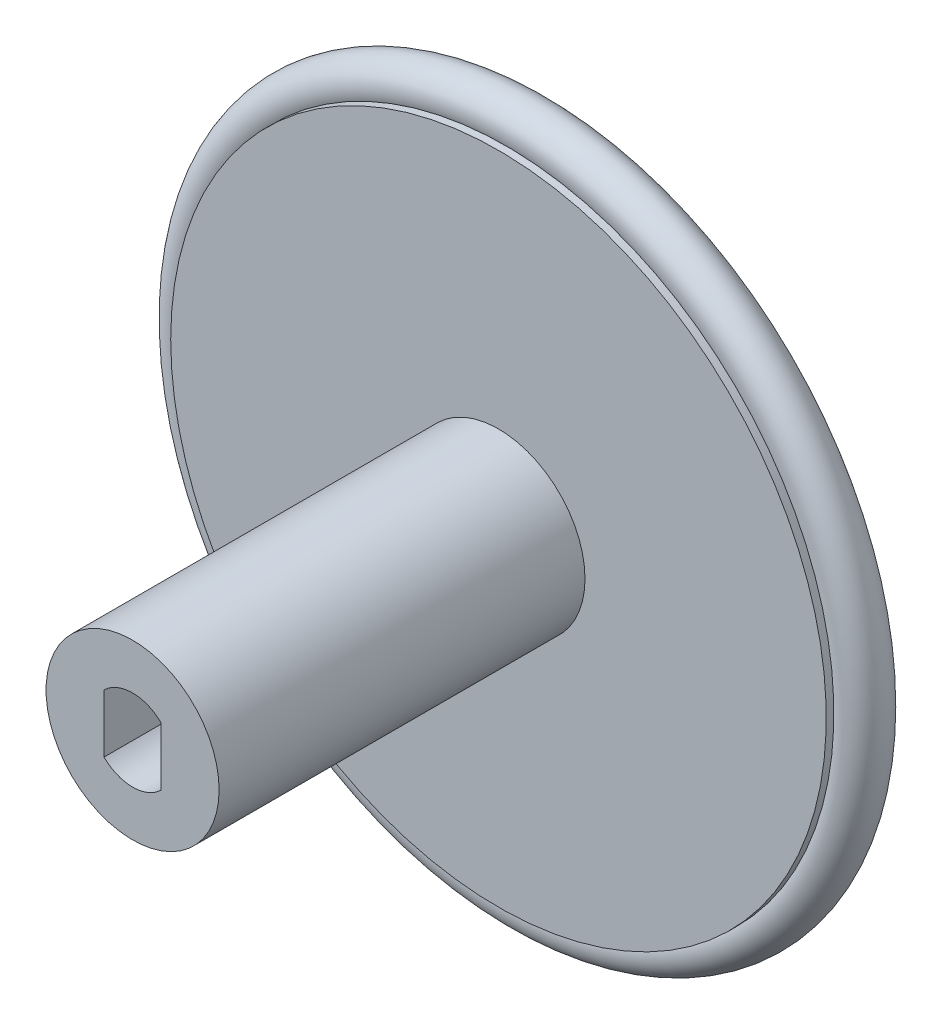
from build123d import *

# Parameters (mm, degrees)
CROQUIS3_R              = 5.675
SALIENTE_EXTRUIR2_DEPTH = 24
SALIENTE_EXTRUIR3_REACH = 48.199
SALIENTE_EXTRUIR3_START = -5
CROQUIS5_R              = 1.5


with BuildPart() as part:
    # Croquis1 → Revolución1 (revolve)
    with BuildSketch(Plane(origin=(0, 0, 0), x_dir=(0, 0, -1), z_dir=(1, 0, 0)), mode=Mode.PRIVATE) as revoluci_n1_sk:
        Polygon((-1.9, 0), (-1.9, 21.5), (-1.4, 21.5), (-0.5, 19.000153831), (0.5, 19.000153831), (1.4, 21.5), (1.9, 21.5), (1.9, 0), align=None)
    revolve(revoluci_n1_sk.sketch.rotate(Axis((0, 0, -6.227056579), (0, 0, 1)), 90), axis=Axis((0, 0, -6.227056579), (0, 0, 1)))

    # Croquis3 → Saliente-Extruir2 (add)
    with BuildSketch(Plane.XY.offset(1.9)):
        Circle(CROQUIS3_R)
        with BuildLine():
            Line((-1.875, 1.907878403), (-1.875, -1.907878403))
            ThreePointArc((-1.875, -1.907878403), (0, -2.675), (1.875, -1.907878403))
            Line((1.875, -1.907878403), (1.875, 1.907878403))
            ThreePointArc((1.875, 1.907878403), (0, 2.675), (-1.875, 1.907878403))
        make_face(mode=Mode.SUBTRACT)
    extrude(amount=SALIENTE_EXTRUIR2_DEPTH)

    # Croquis4 → Saliente-Extruir3 (add, up to next)
    with BuildSketch(Plane.XY.offset(25.9).offset(SALIENTE_EXTRUIR3_START), mode=Mode.PRIVATE) as saliente_extruir3_sk1:
        with BuildLine():
            Line((-1.875, 1.907878403), (-1.875, -1.907878403))
            ThreePointArc((-1.875, -1.907878403), (0, -2.675), (1.875, -1.907878403))
            Line((1.875, -1.907878403), (1.875, 1.907878403))
            ThreePointArc((1.875, 1.907878403), (0, 2.675), (-1.875, 1.907878403))
        make_face()
    saliente_extruir3_tool1 = extrude(saliente_extruir3_sk1.sketch, amount=-SALIENTE_EXTRUIR3_REACH, mode=Mode.PRIVATE) - part.part
    add(saliente_extruir3_tool1.solids().sort_by_distance((0, 0, 20.9))[0])


with BuildPart() as body_2:
    # Croquis5 → Revolución2 (revolve)
    with BuildSketch(Plane(origin=(0, 0, 0), x_dir=(0, 0, -1), z_dir=(1, 0, 0)), mode=Mode.PRIVATE) as revoluci_n2_sk:
        with Locations((0, 22.039552594)):
            Circle(CROQUIS5_R)
    revolve(revoluci_n2_sk.sketch.rotate(Axis((0, 0, 9.093206655), (0, 0, -1)), 90), axis=Axis((0, 0, 9.093206655), (0, 0, -1)))


solid = Compound([part.part, body_2.part])
